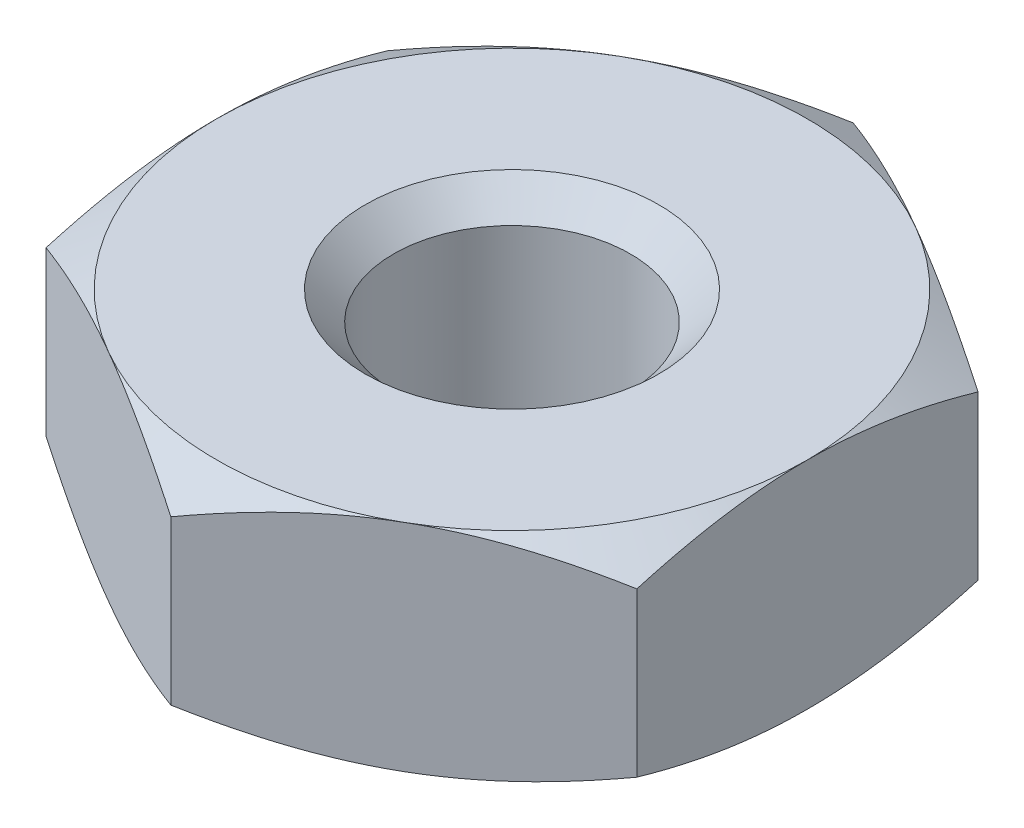
from build123d import *

# Parameters (mm, degrees)
BOSS_EXTRUDE1_DEPTH = 1.4478
SKETCH2_R           = 1.5875
CUT_EXTRUDE1_DEPTH  = 7.709639692
CHAMFER2_SIZE       = 0.381


with BuildPart() as part:
    # Sketch1 → Boss-Extrude1 (new, symmetric)
    with BuildSketch(Plane(origin=(0, 0, 0), x_dir=(1, 0, 0), z_dir=(0, 1, 0))):
        Polygon((0, -4.575385413), (3.9624, -2.287692707), (3.9624, 2.287692707), (0, 4.575385413), (-3.9624, 2.287692707), (-3.9624, -2.287692707), align=None)
    extrude(amount=BOSS_EXTRUDE1_DEPTH, both=True)

    # Sketch2 → Cut-Extrude1 (cut, through all)
    with BuildSketch(Plane(origin=(0, 1.4478, 0), x_dir=(1, 0, 0), z_dir=(0, 1, 0))):
        with Locations(Location((0, 0, 0), (0, 0, 270))):
            Circle(SKETCH2_R)
    extrude(amount=-CUT_EXTRUDE1_DEPTH, mode=Mode.SUBTRACT)

    # Sketch3 → Cut-Revolve2 (revolve, cut)
    with BuildSketch(Plane(origin=(0, 0, 0), x_dir=(0, 0, -1), z_dir=(1, 0, 0))):
        Polygon((-4.575385413, -1.4478), (-4.575385413, -1.093892707), (-3.9624, -1.4478), align=None)
    cut_revolve2 = revolve(axis=Axis((0, 0, 0), (0, -1, 0)), mode=Mode.SUBTRACT)

    # Mirror2: Cut-Revolve2 across plane
    add(cut_revolve2.mirror(Plane.ZX), mode=Mode.SUBTRACT)

    # Chamfer2
    chamfer2_edges = [part.edges().sort_by_distance(p)[0] for p in [
        (0, -1.4478, -1.5875),
        (0, 1.4478, -1.5875),
    ]]
    chamfer(chamfer2_edges, length=CHAMFER2_SIZE)


solid = part.part
